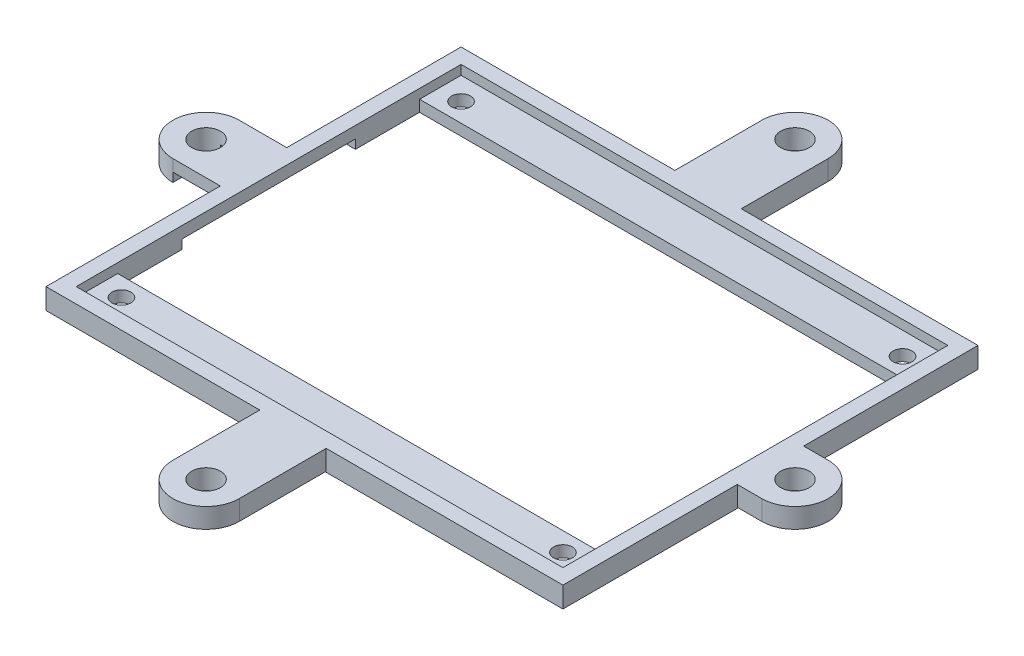
from build123d import *

# Parameters (mm, degrees)
SKETCH1_W           = 68.5
SKETCH1_H           = 55
BOSS_EXTRUDE1_DEPTH = 1.5
SKETCH2_W           = 68.5
SKETCH2_H           = 55
SKETCH2_W_2         = 64.5
SKETCH2_H_2         = 51
BOSS_EXTRUDE2_DEPTH = 1.25
SKETCH3_R           = 1.25
SKETCH3_W           = 64.5
SKETCH3_H           = 40
CUT_EXTRUDE1_DEPTH  = 1.5
SKETCH4_W           = 23
SKETCH4_H           = 1.2
CUT_EXTRUDE2_DEPTH  = 3
SKETCH5_R           = 1.9
BOSS_EXTRUDE3_DEPTH = 2.625
SKETCH5_5_R         = 1.9
BOSS_EXTRUDE4_DEPTH = 1.55
BOSS_EXTRUDE5_DEPTH = 1.2


with BuildPart() as part:
    # Sketch1 → Boss-Extrude1 (new body)
    with BuildSketch(Plane(origin=(0, 0, 0), x_dir=(1, 0, 0), z_dir=(0, 1, 0))):
        with Locations((34.25, 27.5)):
            Rectangle(SKETCH1_W, SKETCH1_H)
    extrude(amount=BOSS_EXTRUDE1_DEPTH)

    # Sketch2 → Boss-Extrude2 (add)
    with BuildSketch(Plane(origin=(0, 1.5, 0), x_dir=(1, 0, 0), z_dir=(0, 1, 0))):
        with Locations((34.25, 27.5)):
            Rectangle(SKETCH2_W, SKETCH2_H)
        with Locations((34.25, 27.5)):
            Rectangle(SKETCH2_W_2, SKETCH2_H_2, mode=Mode.SUBTRACT)
    extrude(amount=BOSS_EXTRUDE2_DEPTH)

    # Sketch3 → Cut-Extrude1 (cut)
    with BuildSketch(Plane(origin=(0, 1.5, 0), x_dir=(1, 0, 0), z_dir=(0, 1, 0))):
        with Locations((5, 50)):
            Circle(SKETCH3_R)
        with Locations((63.5, 50)):
            Circle(SKETCH3_R)
        with Locations((63.5, 5)):
            Circle(SKETCH3_R)
        with Locations((5, 5)):
            Circle(SKETCH3_R)
        with Locations((34.25, 27.5)):
            Rectangle(SKETCH3_W, SKETCH3_H)
    extrude(amount=-CUT_EXTRUDE1_DEPTH, mode=Mode.SUBTRACT)

    # Sketch4 → Cut-Extrude2 (cut)
    with BuildSketch(Plane.ZY):
        with Locations((-27.5, 0.6)):
            Rectangle(SKETCH4_W, SKETCH4_H)
    extrude(amount=-CUT_EXTRUDE2_DEPTH, mode=Mode.SUBTRACT)

    # Sketch5 → Boss-Extrude3 (add)
    # profile 1 of 3: a face of its own
    with BuildSketch(Plane(origin=(0, 2.75, 0), x_dir=(1, 0, 0), z_dir=(0, 1, 0))):
        with BuildLine():
            Line((28.33, 55), (37.13, 55))
            Line((37.13, 55), (37.13, 66.52))
            ThreePointArc((37.13, 66.52), (32.73, 70.92), (28.33, 66.52))
            Line((28.33, 66.52), (28.33, 55))
        make_face()
        with Locations((32.73, 66.52)):
            Circle(SKETCH5_R, mode=Mode.SUBTRACT)
    # profile 2 of 3: a face of its own
    with BuildSketch(Plane(origin=(0, 2.75, 0), x_dir=(1, 0, 0), z_dir=(0, 1, 0))):
        with BuildLine():
            Line((37.13, -11.52), (37.13, 0))
            Line((37.13, 0), (28.33, 0))
            Line((28.33, 0), (28.33, -11.52))
            ThreePointArc((28.33, -11.52), (32.73, -15.92), (37.13, -11.52))
        make_face()
        with Locations((32.73, -11.52)):
            Circle(SKETCH5_R, mode=Mode.SUBTRACT)
    # profile 3 of 3: a face of its own
    with BuildSketch(Plane(origin=(0, 2.75, 0), x_dir=(1, 0, 0), z_dir=(0, 1, 0))):
        with BuildLine():
            Line((71.75, 31.9), (68.5, 31.9))
            Line((68.5, 31.9), (68.5, 23.1))
            Line((68.5, 23.1), (71.75, 23.1))
            ThreePointArc((71.75, 23.1), (76.15, 27.5), (71.75, 31.9))
        make_face()
        with Locations((71.75, 27.5)):
            Circle(SKETCH5_R, mode=Mode.SUBTRACT)
    extrude(amount=-BOSS_EXTRUDE3_DEPTH)

    # Sketch5<5> → Boss-Extrude4 (add)
    with BuildSketch(Plane(origin=(0, 2.75, 0), x_dir=(1, 0, 0), z_dir=(0, 1, 0))):
        with BuildLine():
            Line((0, 23.1), (0, 31.9))
            Line((0, 31.9), (-6.29, 31.9))
            ThreePointArc((-6.29, 31.9), (-10.69, 27.5), (-6.29, 23.1))
            Line((-6.29, 23.1), (0, 23.1))
        make_face()
        with Locations((-6.29, 27.5)):
            Circle(SKETCH5_5_R, mode=Mode.SUBTRACT)
    extrude(amount=-BOSS_EXTRUDE4_DEPTH)

    # Sketch6 → Boss-Extrude5 (add)
    with BuildSketch(Plane.XZ.offset(-1.2)):
        with BuildLine():
            Line((-6.29, -25.6), (-6.29, -23.1))
            ThreePointArc((-6.29, -23.1), (-10.69, -27.5), (-6.29, -31.9))
            Line((-6.29, -31.9), (-6.29, -29.4))
            ThreePointArc((-6.29, -29.4), (-8.19, -27.5), (-6.29, -25.6))
        make_face()
    extrude(amount=BOSS_EXTRUDE5_DEPTH)


solid = part.part
